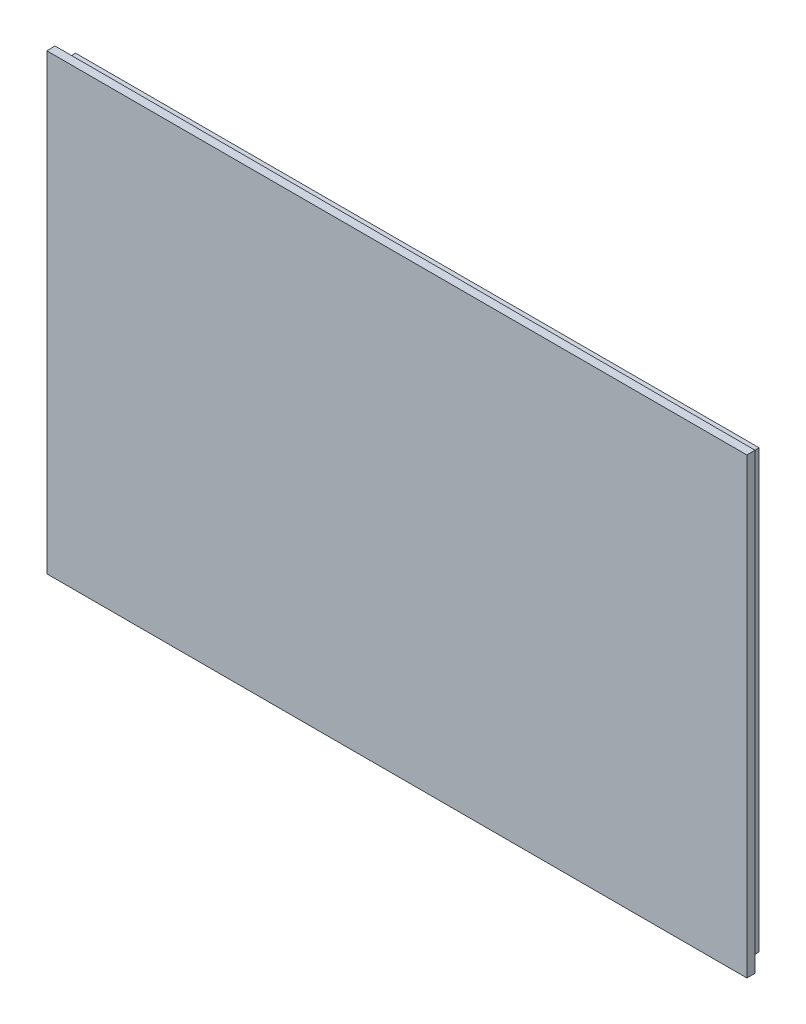
from build123d import *

# Parameters (mm, degrees)
SKETCH1_W           = 170
SKETCH1_H           = 110
BOSS_EXTRUDE1_DEPTH = 2
SKETCH2_W           = 166
SKETCH2_H           = 106
SKETCH2_W_2         = 160
SKETCH2_H_2         = 100
BOSS_EXTRUDE3_DEPTH = 5


with BuildPart() as part:
    # Sketch1 → Boss-Extrude1 (new body)
    with BuildSketch(Plane.XY):
        Rectangle(SKETCH1_W, SKETCH1_H)
    extrude(amount=BOSS_EXTRUDE1_DEPTH)

    # Sketch2 → Boss-Extrude3 (add)
    with BuildSketch(Plane.XY.offset(2)):
        Rectangle(SKETCH2_W, SKETCH2_H)
        Rectangle(SKETCH2_W_2, SKETCH2_H_2, mode=Mode.SUBTRACT)
    extrude(amount=-BOSS_EXTRUDE3_DEPTH)


solid = part.part
